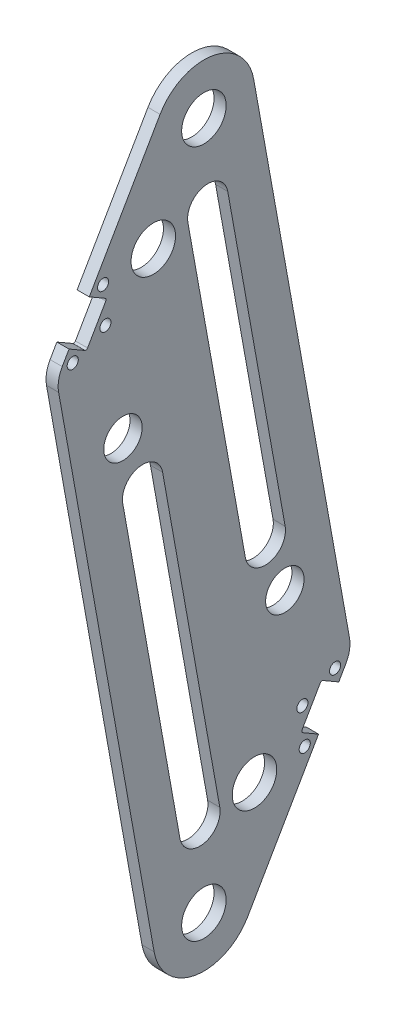
from build123d import *

# Parameters (mm, degrees)
SKETCH_2_R          = 9.5
SKETCH_2_R_2        = 11
EXTRUDE_1_DEPTH     = 6
CUT_EXTRUDE_1_DEPTH = 10
FILLET_1_R          = 25
SKETCH_4_R          = 2.75
CUT_EXTRUDE_2_DEPTH = 10
FILLET_2_R          = 15
FILLET_3_R          = 1


with BuildPart() as part:
    # 草图2 → 凸台-拉伸1 (new body)
    with BuildSketch(Plane(origin=(0, 0, 0), x_dir=(0, 0, -1), z_dir=(1, 0, 0))):
        Polygon((12.494318662, 71.640794729), (-72.751567756, -76.009411684), (-12.535755442, -411.712565336), (72.916857811, -263.704297543), align=None)
        with Locations((-40, -117)):
            Circle(SKETCH_2_R, mode=Mode.SUBTRACT)
        with Locations((25, -296.698729811)):
            Circle(SKETCH_2_R_2, mode=Mode.SUBTRACT)
        with Locations((0, -340)):
            Circle(SKETCH_2_R_2, mode=Mode.SUBTRACT)
        with Locations((-25, -43.301270189)):
            Circle(SKETCH_2_R_2, mode=Mode.SUBTRACT)
        with Locations((40, -222)):
            Circle(SKETCH_2_R, mode=Mode.SUBTRACT)
        Circle(SKETCH_2_R_2, mode=Mode.SUBTRACT)
    extrude(amount=EXTRUDE_1_DEPTH)

    # 草图3 → 切除-拉伸1 (cut)
    with BuildSketch(Plane(origin=(6, 0, 0), x_dir=(0, 0, -1), z_dir=(1, 0, 0))):
        with BuildLine():
            Line((-20.40575236, -141.278289439), (7.842954525, -298.764830322))
            ThreePointArc((7.842954525, -298.764830322), (-0.2344101, -310.373283308), (-11.842863085, -302.295918683))
            Line((-11.842863085, -302.295918683), (-40.09156997, -144.8093778))
            ThreePointArc((-40.09156997, -144.8093778), (-32.014205345, -133.200924814), (-20.40575236, -141.278289439))
        make_face()
        with BuildLine():
            Line((11.783440235, -37.201240644), (40.155401092, -194.665623401))
            ThreePointArc((40.155401092, -194.665623401), (32.087124724, -206.280394877), (20.472353248, -198.212118508))
            Line((20.472353248, -198.212118508), (-7.89960761, -40.747735751))
            ThreePointArc((-7.89960761, -40.747735751), (0.168668759, -29.132964275), (11.783440235, -37.201240644))
        make_face()
    extrude(amount=-CUT_EXTRUDE_1_DEPTH, mode=Mode.SUBTRACT)

    # 圆角1
    fillet_1_edges = [part.edges().sort_by_distance(p)[0] for p in [
        (3, -411.712565336, 12.535755442),
        (3, 71.640794729, -12.494318662),
    ]]
    fillet(fillet_1_edges, radius=FILLET_1_R)

    # 草图4 → 切除-拉伸2 (cut)
    with BuildSketch(Plane(origin=(6, 0, 0), x_dir=(0, 0, -1), z_dir=(1, 0, 0))):
        with Locations((-49.820508076, -46.291651246)):
            Circle(SKETCH_4_R)
        with Locations((-64.820508076, -72.27241336)):
            Circle(SKETCH_4_R)
        with Locations((-48.660254038, -64.282032303)):
            Circle(SKETCH_4_R)
        with Locations((48.660254038, -275.717967697)):
            Circle(SKETCH_4_R)
        with Locations((49.820508076, -293.708348754)):
            Circle(SKETCH_4_R)
        with Locations((64.820508076, -267.72758664)):
            Circle(SKETCH_4_R)
        Polygon((-66.650635095, -65.442286341), (-56.650635095, -48.121778265), (-47.990381057, -53.121778265), (-57.990381057, -70.442286341), align=None)
        Polygon((47.990381057, -286.878221735), (57.990381057, -269.557713659), (66.650635095, -274.557713659), (56.650635095, -291.878221735), align=None)
    extrude(amount=-CUT_EXTRUDE_2_DEPTH, mode=Mode.SUBTRACT)

    # 圆角2
    fillet_2_edges = [part.edges().sort_by_distance(p)[0] for p in [
        (3, -263.704297543, -72.916857811),
        (3, -76.009411684, 72.751567756),
    ]]
    fillet(fillet_2_edges, radius=FILLET_2_R)

    # 圆角3
    fillet_3_edges = [part.edges().sort_by_distance(p)[0] for p in [
        (3, -286.878221735, -47.990381057),
        (3, -269.557713659, -57.990381057),
        (3, -53.121778265, 47.990381057),
        (3, -70.442286341, 57.990381057),
    ]]
    fillet(fillet_3_edges, radius=FILLET_3_R)


solid = part.part
